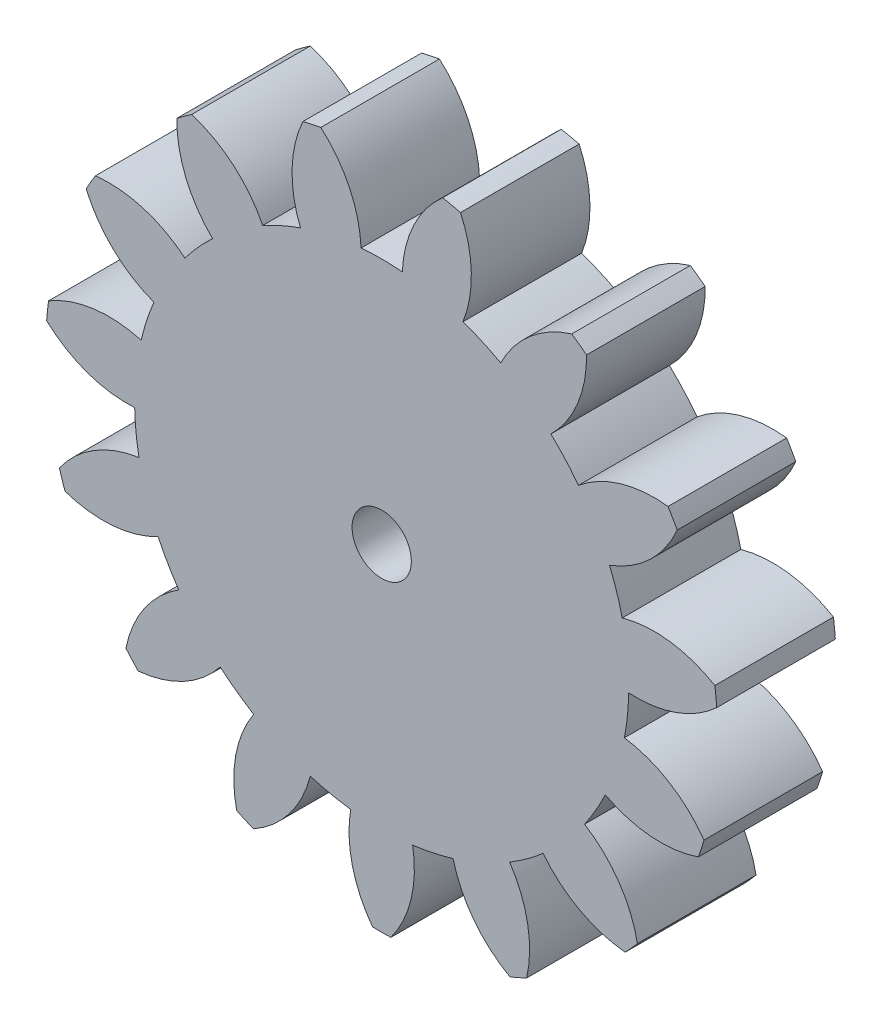
from build123d import *

# Parameters (mm, degrees)
DODANIE_WYCI_GNI_CIE1_DEPTH = 12
OTW_R_6_0_6_1_D             = 6


with BuildPart() as part:
    # Szkic1 → Dodanie-wyciągnięcie1 (new body)
    with BuildSketch(Plane.XY):
        with BuildLine():
            ThreePointArc((-33.898094839, 2.630430818), (-29.769421597, 0.139315972), (-24.993476702, -0.525474417))
            ThreePointArc((-24.993476702, -0.525474417), (-24.862052862, -2.613107053), (-24.556561544, -4.68244446))
            ThreePointArc((-24.556561544, -4.68244446), (-29.089922891, -6.325682363), (-32.610442817, -9.620759807))
            ThreePointArc((-32.610442817, -9.620759807), (-32.335921554, -10.506577809), (-32.037343164, -11.384579176))
            ThreePointArc((-32.037343164, -11.384579176), (-27.252384788, -11.981043133), (-22.618947411, -10.645807579))
            ThreePointArc((-22.618947411, -10.645807579), (-21.649769069, -12.4995), (-20.529013513, -14.265679275))
            ThreePointArc((-20.529013513, -14.265679275), (-24.002080111, -17.610735974), (-25.87800636, -22.052863461))
            ThreePointArc((-25.87800636, -22.052863461), (-25.266924066, -22.750440616), (-24.637043805, -23.431092005))
            ThreePointArc((-24.637043805, -23.431092005), (-20.023163068, -22.029771036), (-16.333396627, -18.925383897))
            ThreePointArc((-16.333396627, -18.925383897), (-14.694043522, -20.224615842), (-12.951812545, -21.382248544))
            ThreePointArc((-12.951812545, -21.382248544), (-14.764059627, -25.850733346), (-14.671027508, -30.671826679))
            ThreePointArc((-14.671027508, -30.671826679), (-13.829045865, -31.06054556), (-12.976775752, -31.426156161))
            ThreePointArc((-12.976775752, -31.426156161), (-9.33175455, -28.269351393), (-7.223653181, -23.932589407))
            ThreePointArc((-7.223653181, -23.932589407), (-5.197584359, -24.452711871), (-3.135125524, -24.801632788))
            ThreePointArc((-3.135125524, -24.801632788), (-2.973199107, -29.620904076), (-0.927294719, -33.98735242))
            ThreePointArc((-0.927294719, -33.98735242), (0, -34), (0.927294719, -33.98735242))
            ThreePointArc((0.927294719, -33.98735242), (2.973199107, -29.620904076), (3.135125524, -24.801632788))
            ThreePointArc((3.135125524, -24.801632788), (5.197584359, -24.452711871), (7.223653181, -23.932589407))
            ThreePointArc((7.223653181, -23.932589407), (9.33175455, -28.269351393), (12.976775752, -31.426156161))
            ThreePointArc((12.976775752, -31.426156161), (13.829045865, -31.06054556), (14.671027508, -30.671826679))
            ThreePointArc((14.671027508, -30.671826679), (14.764059627, -25.850733346), (12.951812545, -21.382248544))
            ThreePointArc((12.951812545, -21.382248544), (14.694043522, -20.224615842), (16.333396627, -18.925383897))
            ThreePointArc((16.333396627, -18.925383897), (20.023163068, -22.029771036), (24.637043805, -23.431092005))
            ThreePointArc((24.637043805, -23.431092005), (25.266924066, -22.750440616), (25.87800636, -22.052863461))
            ThreePointArc((25.87800636, -22.052863461), (24.002080111, -17.610735974), (20.529013513, -14.265679275))
            ThreePointArc((20.529013513, -14.265679275), (21.649769069, -12.4995), (22.618947411, -10.645807579))
            ThreePointArc((22.618947411, -10.645807579), (27.252384788, -11.981043133), (32.037343164, -11.384579176))
            ThreePointArc((32.037343164, -11.384579176), (32.335921554, -10.506577809), (32.610442817, -9.620759807))
            ThreePointArc((32.610442817, -9.620759807), (29.089922891, -6.325682363), (24.556561544, -4.68244446))
            ThreePointArc((24.556561544, -4.68244446), (24.862052862, -2.613107053), (24.993476702, -0.525474417))
            ThreePointArc((24.993476702, -0.525474417), (29.769421597, 0.139315972), (33.898094839, 2.630430818))
            ThreePointArc((33.898094839, 2.630430818), (33.813744443, 3.553967751), (33.704237455, 4.47486062))
            ThreePointArc((33.704237455, 4.47486062), (29.14785373, 6.053139195), (24.338056995, 5.71042754))
            ThreePointArc((24.338056995, 5.71042754), (23.775461851, 7.725115842), (23.046406812, 9.685718046))
            ThreePointArc((23.046406812, 9.685718046), (27.139054966, 12.235586081), (29.897557962, 16.190615427))
            ThreePointArc((29.897557962, 16.190615427), (29.444863729, 17), (28.970263244, 17.796736993))
            ThreePointArc((28.970263244, 17.796736993), (24.165855859, 17.385317995), (19.911281288, 15.115914742))
            ThreePointArc((19.911281288, 15.115914742), (18.577877492, 16.727596028), (17.114403814, 18.222161866))
            ThreePointArc((17.114403814, 18.222161866), (19.81609918, 22.216212199), (20.727461703, 26.951295541))
            ThreePointArc((20.727461703, 26.951295541), (19.984698578, 27.506577809), (19.227067331, 28.041395862))
            ThreePointArc((19.227067331, 28.041395862), (15.00536197, 25.711417373), (12.041664157, 21.907722961))
            ThreePointArc((12.041664157, 21.907722961), (10.16800934, 22.837722896), (8.223164918, 23.607828357))
            ThreePointArc((8.223164918, 23.607828357), (9.066759823, 28.3554534), (7.973399012, 33.051851812))
            ThreePointArc((7.973399012, 33.051851812), (7.068997488, 33.257018425), (6.159336804, 33.437442638))
            ThreePointArc((6.159336804, 33.437442638), (3.250304677, 29.591779107), (2.089933898, 24.911486854))
            ThreePointArc((2.089933898, 24.911486854), (0, 24.999), (-2.089933898, 24.911486854))
            ThreePointArc((-2.089933898, 24.911486854), (-3.250304677, 29.591779107), (-6.159336804, 33.437442638))
            ThreePointArc((-6.159336804, 33.437442638), (-7.068997488, 33.257018425), (-7.973399012, 33.051851812))
            ThreePointArc((-7.973399012, 33.051851812), (-9.066759823, 28.3554534), (-8.223164918, 23.607828357))
            ThreePointArc((-8.223164918, 23.607828357), (-10.16800934, 22.837722896), (-12.041664157, 21.907722961))
            ThreePointArc((-12.041664157, 21.907722961), (-15.00536197, 25.711417373), (-19.227067331, 28.041395862))
            ThreePointArc((-19.227067331, 28.041395862), (-19.984698578, 27.506577809), (-20.727461703, 26.951295541))
            ThreePointArc((-20.727461703, 26.951295541), (-19.81609918, 22.216212199), (-17.114403814, 18.222161866))
            ThreePointArc((-17.114403814, 18.222161866), (-18.577877492, 16.727596028), (-19.911281288, 15.115914742))
            ThreePointArc((-19.911281288, 15.115914742), (-24.165855859, 17.385317995), (-28.970263244, 17.796736993))
            ThreePointArc((-28.970263244, 17.796736993), (-29.444863729, 17), (-29.897557962, 16.190615427))
            ThreePointArc((-29.897557962, 16.190615427), (-27.139054966, 12.235586081), (-23.046406812, 9.685718046))
            ThreePointArc((-23.046406812, 9.685718046), (-23.775461851, 7.725115842), (-24.338056995, 5.71042754))
            ThreePointArc((-24.338056995, 5.71042754), (-29.14785373, 6.053139195), (-33.704237455, 4.47486062))
            ThreePointArc((-33.704237455, 4.47486062), (-33.813744443, 3.553967751), (-33.898094839, 2.630430818))
        make_face()
    extrude(amount=DODANIE_WYCI_GNI_CIE1_DEPTH)

    # Otwór Ø6.0 (6)1 (through all)
    with Locations(Plane.XY.offset(12)):
        with Locations((0, 0)):
            Hole(OTW_R_6_0_6_1_D / 2)


solid = part.part
